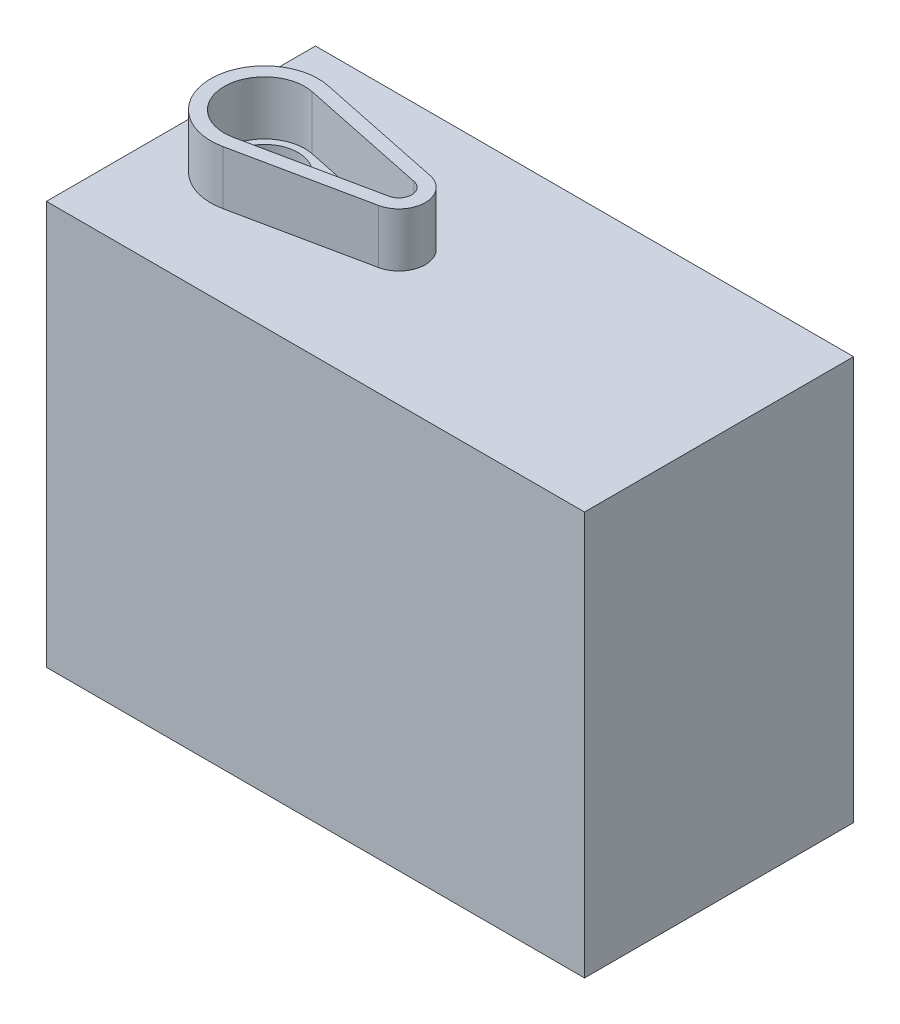
from build123d import *

# Parameters (mm, degrees)
SKETCH1_W           = 40
SKETCH1_H           = 30
BOSS_EXTRUDE1_DEPTH = 20
BOSS_EXTRUDE2_DEPTH = 4
SKETCH4_R           = 2.5
CUT_EXTRUDE1_DEPTH  = 5


with BuildPart() as part:
    # Sketch1 → Boss-Extrude1 (new body)
    with BuildSketch(Plane.XY):
        Rectangle(SKETCH1_W, SKETCH1_H)
    extrude(amount=-BOSS_EXTRUDE1_DEPTH)

    # Sketch3 → Boss-Extrude2 (add)
    with BuildSketch(Plane(origin=(0, 15, 0), x_dir=(1, 0, 0), z_dir=(0, 1, 0))):
        with BuildLine():
            Line((-12.97722879, 13.914589169), (-3.400294542, 11.921916457))
            ThreePointArc((-3.400294542, 11.921916457), (-1.837109147, 10), (-3.400294542, 8.078083543))
            Line((-3.400294542, 8.078083543), (-12.97722879, 6.085410831))
            ThreePointArc((-12.97722879, 6.085410831), (-17.790166122, 10), (-12.97722879, 13.914589169))
        make_face()
        with BuildLine():
            Line((-13.18093595, 12.935557304), (-3.604001703, 10.942884592))
            ThreePointArc((-3.604001703, 10.942884592), (-2.837109147, 10), (-3.604001703, 9.057115408))
            Line((-3.604001703, 9.057115408), (-13.18093595, 7.064442696))
            ThreePointArc((-13.18093595, 7.064442696), (-16.790166122, 10), (-13.18093595, 12.935557304))
        make_face(mode=Mode.SUBTRACT)
    extrude(amount=BOSS_EXTRUDE2_DEPTH)

    # Sketch4 → Cut-Extrude1 (cut)
    with BuildSketch(Plane(origin=(0, 15, 0), x_dir=(1, 0, 0), z_dir=(0, 1, 0))):
        with Locations(Location((-13.791737359, 10, 0), (0, 0, 270))):
            Circle(SKETCH4_R)
    extrude(amount=-CUT_EXTRUDE1_DEPTH, mode=Mode.SUBTRACT)


solid = part.part
